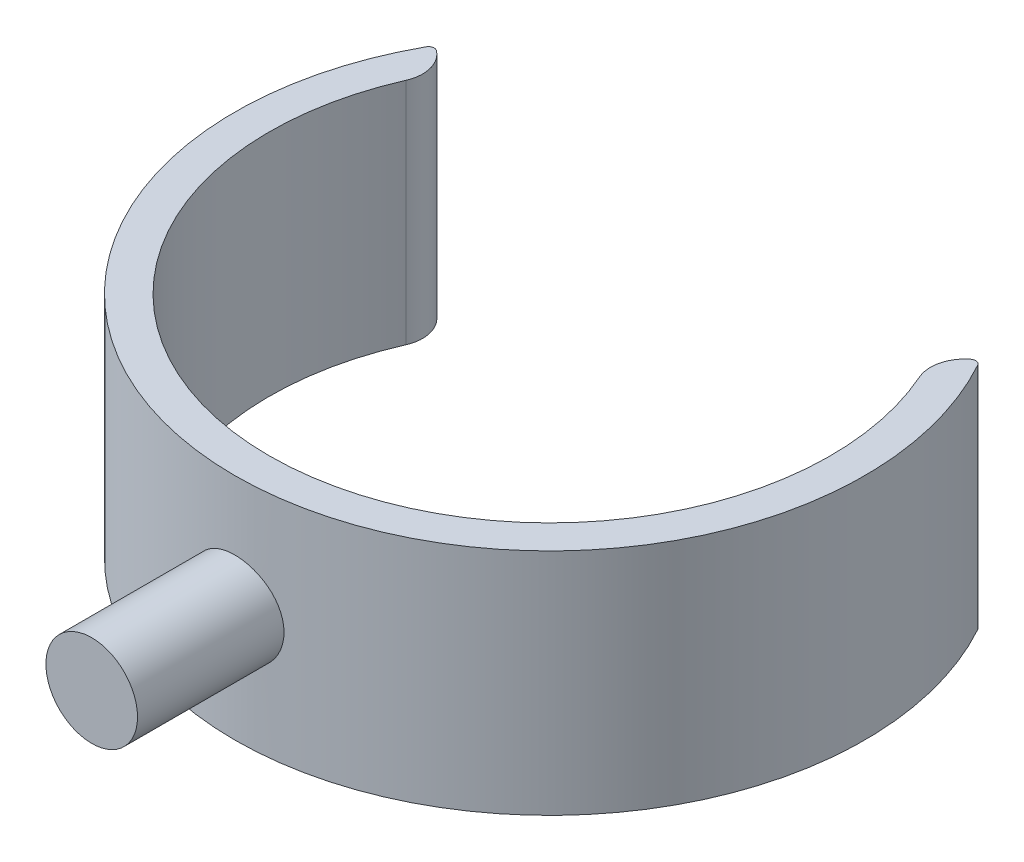
from build123d import *

# Parameters (mm, degrees)
EXTRUIR1_DEPTH      = 20
EXTRUIR2_REACH      = 85.732
EXTRUIR2_END_RADIUS = 27.5
EXTRUIR2_START      = 40
CROQUIS2_R          = 4
REDONDEO1_R         = 3
REDONDEO2_R         = 0.5


with BuildPart() as part:
    # Croquis1 → Extruir1 (new body)
    with BuildSketch(Plane(origin=(0, 0, 0), x_dir=(1, 0, 0), z_dir=(0, 1, 0))):
        with BuildLine():
            Line((23.815698604, 13.75), (21.217622393, 12.25))
            ThreePointArc((21.217622393, 12.25), (0, -24.5), (-21.217622393, 12.25))
            Line((-21.217622393, 12.25), (-23.815698604, 13.75))
            ThreePointArc((-23.815698604, 13.75), (0, -27.5), (23.815698604, 13.75))
        make_face()
    extrude(amount=EXTRUIR1_DEPTH)

    # Extruir2: up to this cylinder (the profile starts outside it)
    extruir2_end = Plane(origin=(0, 10, 0), z_dir=(0, -1, 0)) * Cylinder(EXTRUIR2_END_RADIUS, 227.464, mode=Mode.PRIVATE)
    # Croquis2 → Extruir2 (add, up to the surface)
    with BuildSketch(Plane.XY.offset(EXTRUIR2_START), mode=Mode.PRIVATE) as extruir2_sk1:
        with Locations((0, 10)):
            Circle(CROQUIS2_R)
    extruir2_tool1 = extrude(extruir2_sk1.sketch, amount=-EXTRUIR2_REACH, mode=Mode.PRIVATE) - extruir2_end
    add(extruir2_tool1.solids().sort_by_distance((0, 10, 40))[0])

    # Redondeo1
    redondeo1_edges = [part.edges().sort_by_distance(p)[0] for p in [
        (21.217622393, 10, -12.25),
        (-21.217622393, 10, -12.25),
    ]]
    fillet(redondeo1_edges, radius=REDONDEO1_R)

    # Redondeo2
    redondeo2_edges = [part.edges().sort_by_distance(p)[0] for p in [
        (23.815698604, 10, -13.75),
        (-23.815698604, 10, -13.75),
    ]]
    fillet(redondeo2_edges, radius=REDONDEO2_R)


solid = part.part
